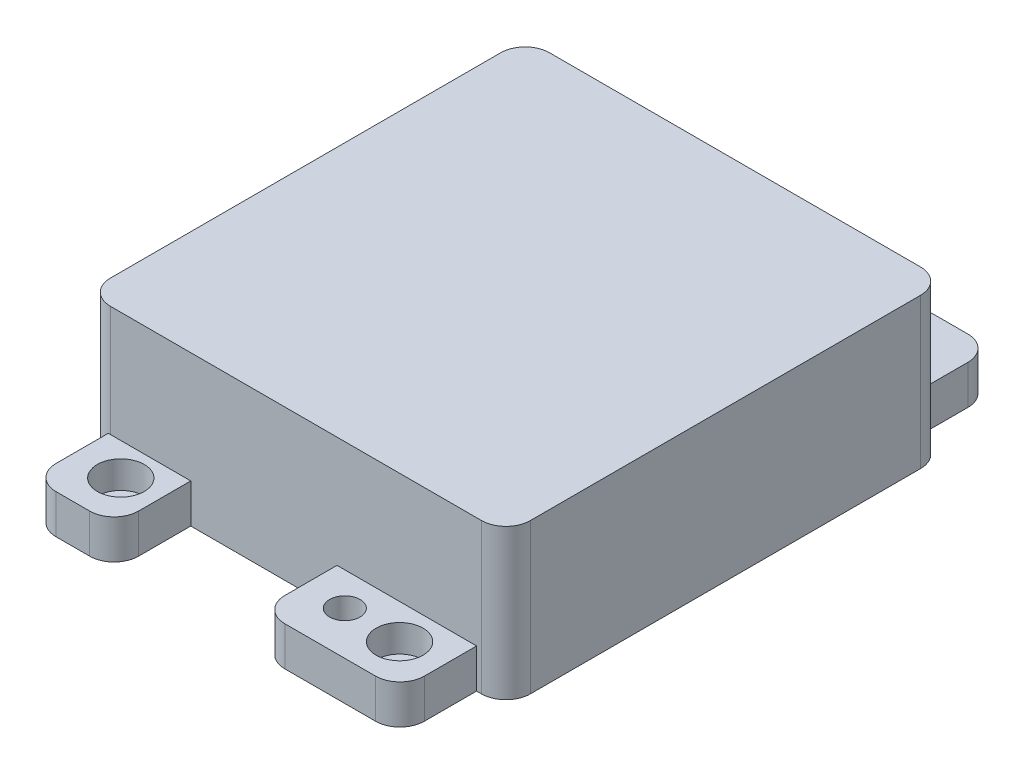
from build123d import *

# Parameters (mm, degrees)
SKETCH1_W                  = 27.2796
SKETCH1_H                  = 28.5242
ENCLOSURE_DEPTH            = 9.7536
SKETCH2_W                  = 9.0678
SKETCH2_H                  = 4.9784
SKETCH2_W_2                = 5.3594
MOUNTING_TABS_DEPTH        = 2.54
SMALL_MOUNTING_HOLES_REACH = 26.663
SKETCH3_R                  = 1.0414
SKETCH3_R_2                = 0.9906
LARGE_MOUNTING_HOLES_REACH = 27.522
SKETCH4_R                  = 0.762
SKETCH4_R_2                = 0.7874
SKETCH4_R_3                = 0.7239
SKETCH5_R                  = 1.524
CUT_EXTRUDE1_DEPTH         = 1.778
FILLET1_R                  = 1.5875
FILLET2_R                  = 1.5875


with BuildPart() as part:
    # Sketch1 → Enclosure (new body)
    with BuildSketch(Plane(origin=(0, 0, 0), x_dir=(1, 0, 0), z_dir=(0, 1, 0))):
        Rectangle(SKETCH1_W, SKETCH1_H)
    extrude(amount=ENCLOSURE_DEPTH)

    # Sketch2 → Mounting Tabs (add)
    with BuildSketch(Plane(origin=(0, 0, 0), x_dir=(1, 0, 0), z_dir=(0, 1, 0))):
        with Locations((-7.6581, 16.7513)):
            Rectangle(SKETCH2_W, SKETCH2_H)
        with Locations((9.0551, 16.7513)):
            Rectangle(SKETCH2_W_2, SKETCH2_H)
        with Locations((-9.5123, -16.7513)):
            Rectangle(SKETCH2_W_2, SKETCH2_H)
        with Locations((7.2009, -16.7513)):
            Rectangle(SKETCH2_W, SKETCH2_H)
    extrude(amount=MOUNTING_TABS_DEPTH)

    # Sketch3 → Small Mounting Holes (cut, up to next)
    with BuildSketch(Plane(origin=(0, 2.54, 0), x_dir=(1, 0, 0), z_dir=(0, 1, 0)), mode=Mode.PRIVATE) as small_mounting_holes_sk1:
        with Locations(Location((-5.842, 16.4211, 0), (0, 0, 270))):
            Circle(SKETCH3_R)
    small_mounting_holes_tool1 = extrude(small_mounting_holes_sk1.sketch, amount=-SMALL_MOUNTING_HOLES_REACH, mode=Mode.PRIVATE) & part.part
    # Sketch3 → Small Mounting Holes (cut, up to next)
    with BuildSketch(Plane(origin=(0, 2.54, 0), x_dir=(1, 0, 0), z_dir=(0, 1, 0)), mode=Mode.PRIVATE) as small_mounting_holes_sk2:
        with Locations(Location((5.334, -16.4211, 0), (0, 0, 270))):
            Circle(SKETCH3_R_2)
    small_mounting_holes_tool2 = extrude(small_mounting_holes_sk2.sketch, amount=-SMALL_MOUNTING_HOLES_REACH, mode=Mode.PRIVATE) & part.part
    add(small_mounting_holes_tool1.solids().sort_by_distance((-5.842, 2.54, -16.4211))[0], mode=Mode.SUBTRACT)
    add(small_mounting_holes_tool2.solids().sort_by_distance((5.334, 2.54, 16.4211))[0], mode=Mode.SUBTRACT)

    # Sketch4 → Large Mounting Holes (cut, up to next)
    with BuildSketch(Plane.XZ, mode=Mode.PRIVATE) as large_mounting_holes_sk1:
        with Locations(Location((-9.271, 16.3703, 0), (0, 0, 270))):
            Circle(SKETCH4_R)
    large_mounting_holes_tool1 = extrude(large_mounting_holes_sk1.sketch, amount=-LARGE_MOUNTING_HOLES_REACH, mode=Mode.PRIVATE) & part.part
    # Sketch4 → Large Mounting Holes (cut, up to next)
    with BuildSketch(Plane.XZ, mode=Mode.PRIVATE) as large_mounting_holes_sk2:
        with Locations(Location((8.9916, 16.5227, 0), (0, 0, 270))):
            Circle(SKETCH4_R_2)
    large_mounting_holes_tool2 = extrude(large_mounting_holes_sk2.sketch, amount=-LARGE_MOUNTING_HOLES_REACH, mode=Mode.PRIVATE) & part.part
    # Sketch4 → Large Mounting Holes (cut, up to next)
    with BuildSketch(Plane.XZ, mode=Mode.PRIVATE) as large_mounting_holes_sk3:
        with Locations(Location((8.9662, -16.4719, 0), (0, 0, 270))):
            Circle(SKETCH4_R)
    large_mounting_holes_tool3 = extrude(large_mounting_holes_sk3.sketch, amount=-LARGE_MOUNTING_HOLES_REACH, mode=Mode.PRIVATE) & part.part
    # Sketch4 → Large Mounting Holes (cut, up to next)
    with BuildSketch(Plane.XZ, mode=Mode.PRIVATE) as large_mounting_holes_sk4:
        with Locations(Location((-9.3091, -16.51, 0), (0, 0, 270))):
            Circle(SKETCH4_R_3)
    large_mounting_holes_tool4 = extrude(large_mounting_holes_sk4.sketch, amount=-LARGE_MOUNTING_HOLES_REACH, mode=Mode.PRIVATE) & part.part
    add(large_mounting_holes_tool1.solids().sort_by_distance((-9.271, 0, 16.3703))[0], mode=Mode.SUBTRACT)
    add(large_mounting_holes_tool2.solids().sort_by_distance((8.9916, 0, 16.5227))[0], mode=Mode.SUBTRACT)
    add(large_mounting_holes_tool3.solids().sort_by_distance((8.9662, 0, -16.4719))[0], mode=Mode.SUBTRACT)
    add(large_mounting_holes_tool4.solids().sort_by_distance((-9.3091, 0, -16.51))[0], mode=Mode.SUBTRACT)

    # Sketch5 → Cut-Extrude1 (cut)
    with BuildSketch(Plane(origin=(0, 2.54, 0), x_dir=(1, 0, 0), z_dir=(0, 1, 0))):
        with Locations(Location((-9.271, -16.3703, 0), (0, 0, 270))):
            Circle(SKETCH5_R)
        with Locations(Location((8.9916, -16.5227, 0), (0, 0, 270))):
            Circle(SKETCH5_R)
        with Locations(Location((-9.3091, 16.51, 0), (0, 0, 270))):
            Circle(SKETCH5_R)
    extrude(amount=-CUT_EXTRUDE1_DEPTH, mode=Mode.SUBTRACT)

    # Fillet1
    fillet1_edges = [part.edges().sort_by_distance(p)[0] for p in [
        (-13.6398, 4.8768, -14.2621),
        (13.6398, 4.8768, -14.2621),
        (-13.6398, 4.8768, 14.2621),
        (13.6398, 4.8768, 14.2621),
    ]]
    fillet(fillet1_edges, radius=FILLET1_R)

    # Fillet2
    fillet2_edges = [part.edges().sort_by_distance(p)[0] for p in [
        (-12.192, 1.27, 19.2405),
        (2.667, 1.27, 19.2405),
        (-6.8326, 1.27, 19.2405),
        (11.7348, 1.27, 19.2405),
        (-12.192, 1.27, -19.2405),
        (-3.1242, 1.27, -19.2405),
        (6.3754, 1.27, -19.2405),
        (11.7348, 1.27, -19.2405),
    ]]
    fillet(fillet2_edges, radius=FILLET2_R)


solid = part.part
